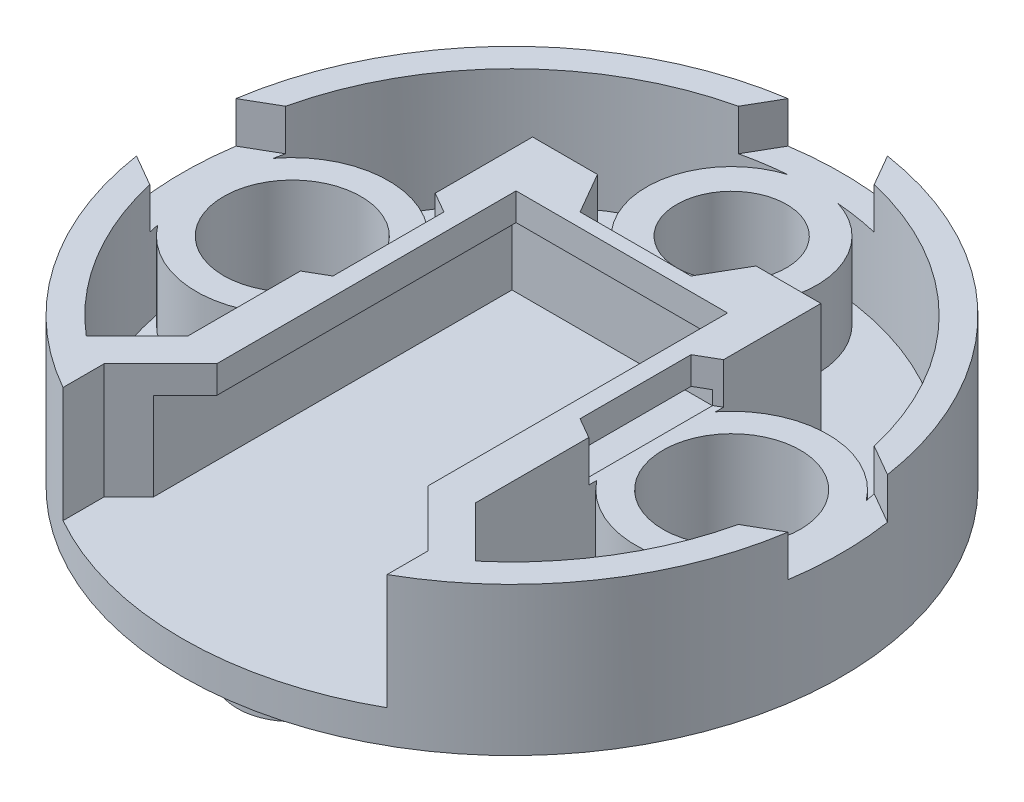
from build123d import *

# Parameters (mm, degrees)
SKETCH1_R           = 12
BOSS_EXTRUDE1_DEPTH = 5.4
CUT_EXTRUDE1_START  = -4.2
CUT_EXTRUDE1_DEPTH  = 4.2
BOSS_EXTRUDE2_DEPTH = 1
SKETCH4_R           = 2.5
SKETCH4_R_2         = 2
CUT_EXTRUDE2_DEPTH  = 11
SKETCH5_R           = 2
BOSS_EXTRUDE3_DEPTH = 2
CUT_EXTRUDE3_DEPTH  = 4.3
CUT_EXTRUDE4_DEPTH  = 1.5


with BuildPart() as part:
    # Sketch1 → Boss-Extrude1 (new body)
    with BuildSketch(Plane(origin=(0, 0, 0), x_dir=(1, 0, 0), z_dir=(0, 1, 0))):
        with Locations(Location((0, 0, 0), (0, 0, 90))):
            Circle(SKETCH1_R)
    extrude(amount=BOSS_EXTRUDE1_DEPTH)

    # Sketch2 → Cut-Extrude1 (cut)
    with BuildSketch(Plane(origin=(0, 5.4, 0), x_dir=(1, 0, 0), z_dir=(0, 1, 0)).offset(CUT_EXTRUDE1_START)):
        with BuildLine():
            Line((5, -5), (5, 5))
            Line((5, 5), (-5, 5))
            Line((-5, 5), (-5, -5))
            Line((-5, -5), (-5, -8.049401897))
            Line((-5, -8.049401897), (-5.9, -8.949401897))
            Line((-5.9, -8.949401897), (-5.9, -10.449401897))
            ThreePointArc((-5.9, -10.449401897), (0, -12), (5.9, -10.449401897))
            Line((5.9, -10.449401897), (5.9, -8.949401897))
            Line((5.9, -8.949401897), (5, -8.049401897))
            Line((5, -8.049401897), (5, -5))
        make_face()
    extrude(amount=CUT_EXTRUDE1_DEPTH, mode=Mode.SUBTRACT)

    # Sketch3 → Boss-Extrude2 (add)
    with BuildSketch(Plane(origin=(0, 5.4, 0), x_dir=(1, 0, 0), z_dir=(0, 1, 0))):
        Polygon((5, -8.049401897), (3.85, -6.899401897), (3.85, 4), (-3.85, 4), (-3.85, -6.899401897), (-5, -8.049401897), (-5, 5), (5, 5), align=None)
    extrude(amount=-BOSS_EXTRUDE2_DEPTH)

    # Sketch4 → Cut-Extrude2 (cut)
    with BuildSketch(Plane(origin=(0, 5.4, 0), x_dir=(1, 0, 0), z_dir=(0, 1, 0))):
        with Locations(Location((-8, 0, 0), (0, 0, 270))):
            Circle(SKETCH4_R)
        with Locations(Location((8, 0, 0), (0, 0, 270))):
            Circle(SKETCH4_R)
        with Locations(Location((0, 8, 0), (0, 0, 270))):
            Circle(SKETCH4_R_2)
    extrude(amount=-CUT_EXTRUDE2_DEPTH, mode=Mode.SUBTRACT)

    # Sketch5 → Boss-Extrude3 (add)
    with BuildSketch(Plane.XZ):
        with Locations(Location((0, 8, 0), (0, 0, 90))):
            Circle(SKETCH5_R)
    extrude(amount=BOSS_EXTRUDE3_DEPTH)

    # Sketch6 → Cut-Extrude3 (cut)
    with BuildSketch(Plane(origin=(0, 5.4, 0), x_dir=(1, 0, 0), z_dir=(0, 1, 0))):
        with BuildLine():
            ThreePointArc((-10.796875, -2.104160221), (-9.487597374, -5.566461719), (-7.103967779, -8.398430913))
            Line((-7.103967779, -8.398430913), (-5.25, -6.544463134))
            Line((-5.25, -6.544463134), (-5.25, -2.165063509))
            ThreePointArc((-5.25, -2.165063509), (-8.038426801, -3.499789048), (-10.796875, -2.104160221))
        make_face()
        with BuildLine():
            ThreePointArc((-10.796875, 2.104160221), (-8.038426801, 3.499789048), (-5.25, 2.165063509))
            Line((-5.25, 2.165063509), (-5.25, 6))
            Line((-5.25, 6), (-2.368543856, 6))
            ThreePointArc((-2.368543856, 6), (-2.974984046, 8.871475717), (-0.915039062, 10.961875))
            ThreePointArc((-0.915039062, 10.961875), (-7.34213937, 8.191031039), (-10.796875, 2.104160221))
        make_face()
        with BuildLine():
            Line((5.25, -6.571554413), (7.089279147, -8.41083356))
            ThreePointArc((7.089279147, -8.41083356), (9.482729549, -5.574750246), (10.796875, -2.104160221))
            ThreePointArc((10.796875, -2.104160221), (8.038426801, -3.499789048), (5.25, -2.165063509))
            Line((5.25, -2.165063509), (5.25, -6.571554413))
        make_face()
        with BuildLine():
            ThreePointArc((0.915039062, 10.961875), (2.974984046, 8.871475717), (2.368543856, 6))
            Line((2.368543856, 6), (5.25, 6))
            Line((5.25, 6), (5.25, 2.165063509))
            ThreePointArc((5.25, 2.165063509), (8.038426801, 3.499789048), (10.796875, 2.104160221))
            ThreePointArc((10.796875, 2.104160221), (7.34213937, 8.191031039), (0.915039062, 10.961875))
        make_face()
    extrude(amount=-CUT_EXTRUDE3_DEPTH, mode=Mode.SUBTRACT)

    # Sketch7 → Cut-Extrude4 (cut)
    with BuildSketch(Plane(origin=(0, 5.4, 0), x_dir=(1, 0, 0), z_dir=(0, 1, 0))):
        Polygon((11.5, 2.020725942), (12.766112926, 1.289735303), (12.766112926, -1.289735303), (11.5, -2.020725942), (8, -4.041451884), (4.5, -2.020725942), (4.5, 2.020725942), (8, 4.041451884), align=None)
        Polygon((2.020725942, 4.5), (4.041451884, 8), (2.020725942, 11.5), (1.300085439, 12.748185966), (-1.300085439, 12.748185966), (-2.020725942, 11.5), (-4.041451884, 8), (-2.020725942, 4.5), align=None)
        Polygon((-4.5, -2.020725942), (-4.5, 2.020725942), (-8, 4.041451884), (-11.5, 2.020725942), (-12.378564681, 1.513486387), (-12.378564681, -1.513486387), (-11.5, -2.020725942), (-8, -4.041451884), align=None)
    extrude(amount=-CUT_EXTRUDE4_DEPTH, mode=Mode.SUBTRACT)


solid = part.part
